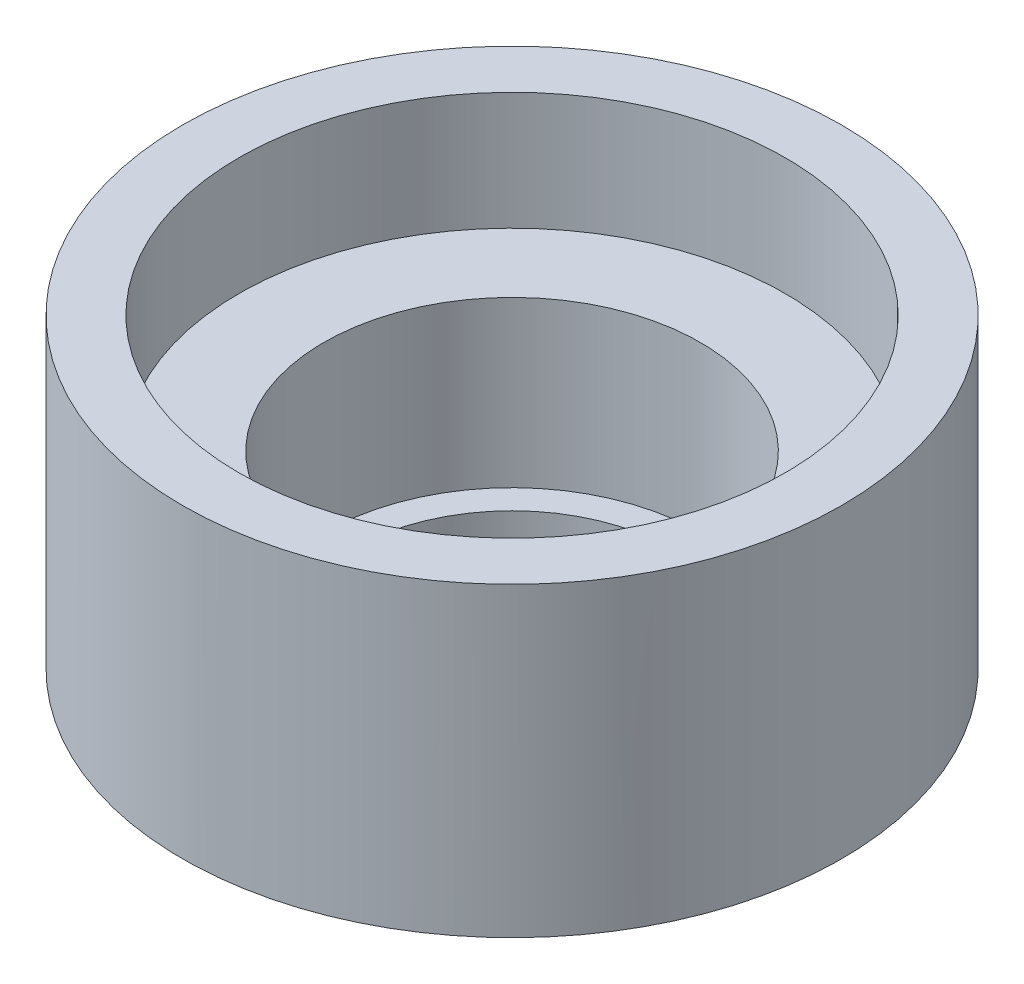
from build123d import *

# Parameters (mm, degrees)
ESQUISSE3_R               = 3.5
SHAPE_DEPTH               = 3.75
ESQUISSE4_R               = 2.9
CUT_EXTRUDE_5_4D_DEPTH    = 3
ESQUISSE5_R               = 1.7
CUT_EXTRUDE_3D_DEPTH      = 3
ESQUISSE6_R               = 3.5
ESQUISSE6_R_2             = 2.3
ENL_V_MAT_EXTRU_2_DEPTH   = 0.5
BOSS_EXTRU_1_START        = 1.75
ESQUISSE9_R               = 2.9
ESQUISSE9_R_2             = 2
BOSS_EXTRU_1_DEPTH        = 1.75
ESQUISSE10_R              = 2.619168903
ERRORPRINTERREMOVER_DEPTH = 0.2


with BuildPart() as part:
    # Esquisse3 → Shape (new body)
    with BuildSketch(Plane(origin=(0, 0, 0), x_dir=(1, 0, 0), z_dir=(0, 1, 0))):
        with Locations(Location((0, 0, 0), (0, 0, 270))):
            Circle(ESQUISSE3_R)
    extrude(amount=SHAPE_DEPTH)

    # Esquisse4 → 5_4D (cut)
    with BuildSketch(Plane(origin=(0, 3.75, 0), x_dir=(1, 0, 0), z_dir=(0, 1, 0))):
        with Locations(Location((0, 0, 0), (0, 0, 270))):
            Circle(ESQUISSE4_R)
    extrude(amount=-CUT_EXTRUDE_5_4D_DEPTH, mode=Mode.SUBTRACT)

    # Esquisse5 → 3D (cut)
    with BuildSketch(Plane(origin=(0, 0.75, 0), x_dir=(1, 0, 0), z_dir=(0, 1, 0))):
        with Locations(Location((0, 0, 0), (0, 0, 270))):
            Circle(ESQUISSE5_R)
    extrude(amount=-CUT_EXTRUDE_3D_DEPTH, mode=Mode.SUBTRACT)

    # Esquisse6 → Enlèv. mat.-Extru.2 (cut)
    with BuildSketch(Plane.XZ):
        with Locations(Location((0, 0, 0), (0, 0, 270))):
            Circle(ESQUISSE6_R)
        with Locations(Location((0, 0, 0), (0, 0, 270))):
            Circle(ESQUISSE6_R_2, mode=Mode.SUBTRACT)
    extrude(amount=-ENL_V_MAT_EXTRU_2_DEPTH, mode=Mode.SUBTRACT)

    # Esquisse9 → Boss.-Extru.1 (add)
    with BuildSketch(Plane(origin=(0, 0.75, 0), x_dir=(1, 0, 0), z_dir=(0, 1, 0)).offset(BOSS_EXTRU_1_START)):
        with Locations(Location((0, 0, 0), (0, 0, 270))):
            Circle(ESQUISSE9_R)
        with Locations(Location((0, 0, 0), (0, 0, 270))):
            Circle(ESQUISSE9_R_2, mode=Mode.SUBTRACT)
    extrude(amount=-BOSS_EXTRU_1_DEPTH)

    # Esquisse10 → ErrorPrinterRemover (cut)
    with BuildSketch(Plane.XZ):
        Circle(ESQUISSE10_R)
    extrude(amount=-ERRORPRINTERREMOVER_DEPTH, mode=Mode.SUBTRACT)


solid = part.part
